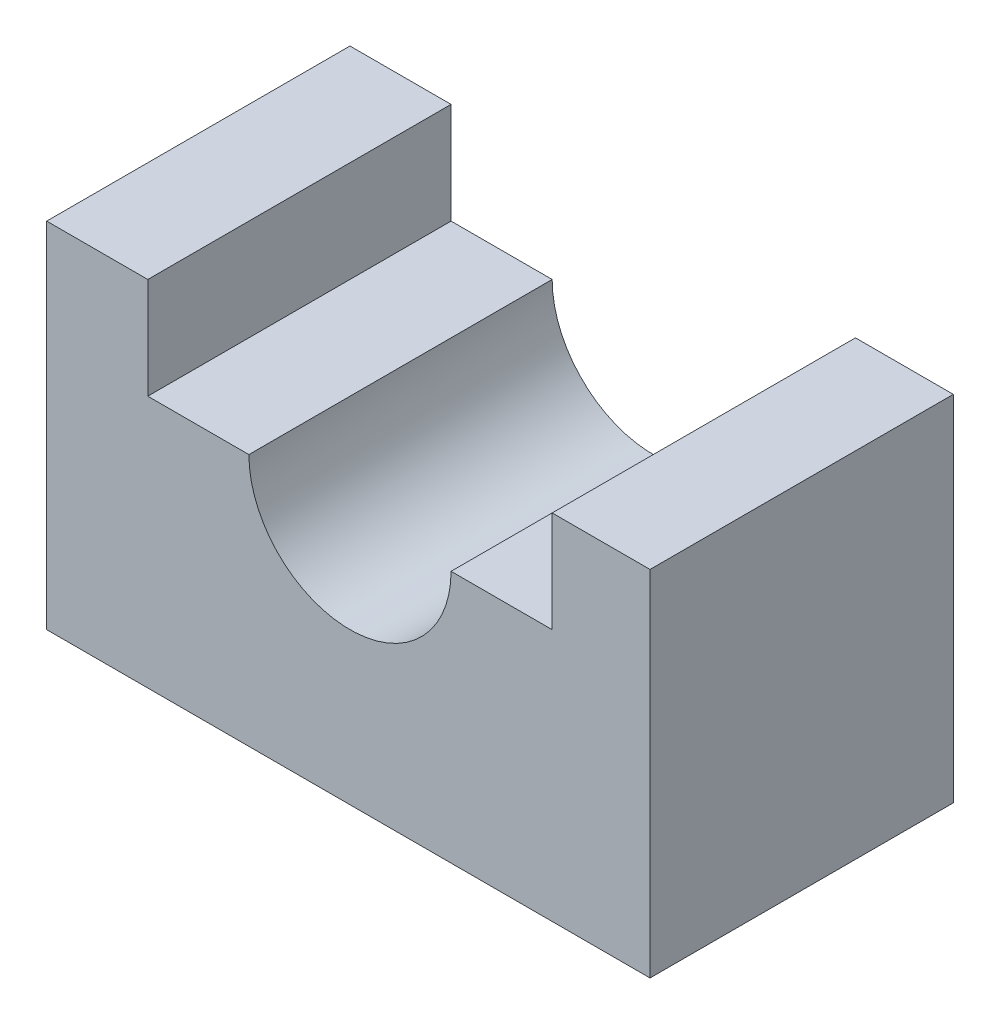
from build123d import *

# Parameters (mm, degrees)
BOSS_EXTRUDE2_DEPTH = 30


with BuildPart() as part:
    # Sketch1 → Boss-Extrude2 (new body)
    with BuildSketch(Plane.XY):
        with BuildLine():
            Line((-30, 17.5), (-20, 17.5))
            Line((-20, 17.5), (-20, 7.5))
            Line((-20, 7.5), (-10, 7.5))
            ThreePointArc((-10, 7.5), (0, -2.5), (10, 7.5))
            Line((10, 7.5), (20, 7.5))
            Line((20, 7.5), (20, 17.5))
            Line((20, 17.5), (29.681023884, 17.5))
            Line((29.681023884, 17.5), (29.681023884, 16.984704446))
            Line((29.681023884, 16.984704446), (29.681023884, -17.5))
            Line((29.681023884, -17.5), (-30, -17.5))
            Line((-30, -17.5), (-30, 16.984704446))
            Line((-30, 16.984704446), (-30, 17.5))
        make_face()
    extrude(amount=BOSS_EXTRUDE2_DEPTH)


solid = part.part
